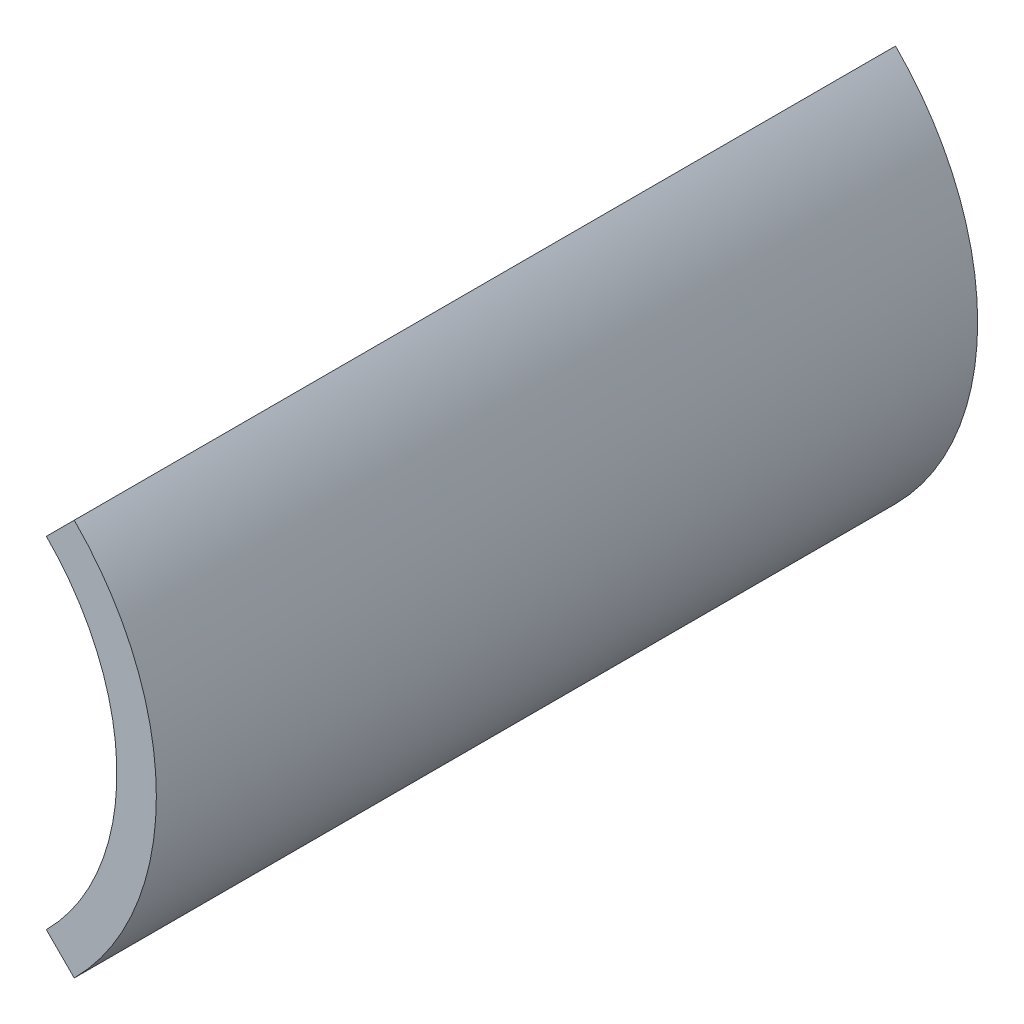
from build123d import *

# Parameters (mm, degrees)
BOSS_EXTRUDE1_DEPTH = 26


with BuildPart() as part:
    # Sketch1 → Boss-Extrude1 (new, symmetric)
    with BuildSketch(Plane.XY):
        with BuildLine():
            Line((10.783378413, 10.783378413), (12.551145366, 12.551145366))
            ThreePointArc((12.551145366, 12.551145366), (17.75, 0), (12.551145366, -12.551145366))
            Line((12.551145366, -12.551145366), (10.783378413, -10.783378413))
            ThreePointArc((10.783378413, -10.783378413), (15.25, 0), (10.783378413, 10.783378413))
        make_face()
    extrude(amount=BOSS_EXTRUDE1_DEPTH, both=True)


solid = part.part
